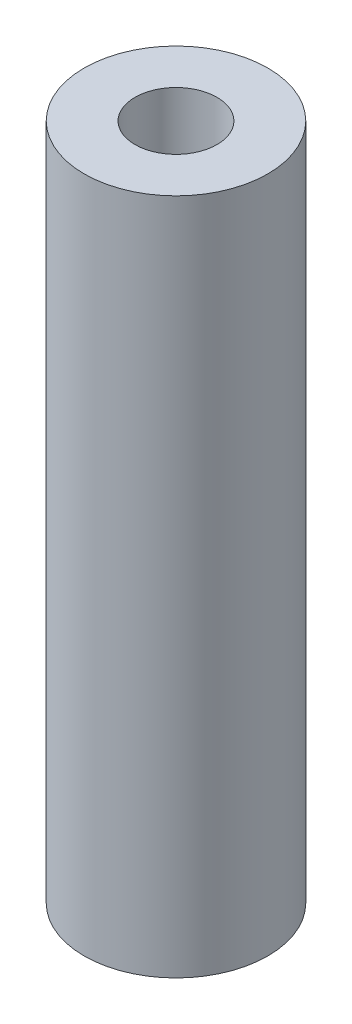
from build123d import *

# Parameters (mm, degrees)
SKETCH1_R           = 10.84040022
SKETCH1_R_2         = 4.84040022
BOSS_EXTRUDE1_DEPTH = 80


with BuildPart() as part:
    # Sketch1 → Boss-Extrude1 (new body)
    with BuildSketch(Plane(origin=(0, 0, 0), x_dir=(1, 0, 0), z_dir=(0, 1, 0))):
        with Locations(Location((0, 0, 0), (0, 0, 270))):
            Circle(SKETCH1_R)
        with Locations(Location((0, 0, 0), (0, 0, 270))):
            Circle(SKETCH1_R_2, mode=Mode.SUBTRACT)
    extrude(amount=BOSS_EXTRUDE1_DEPTH)


solid = part.part
